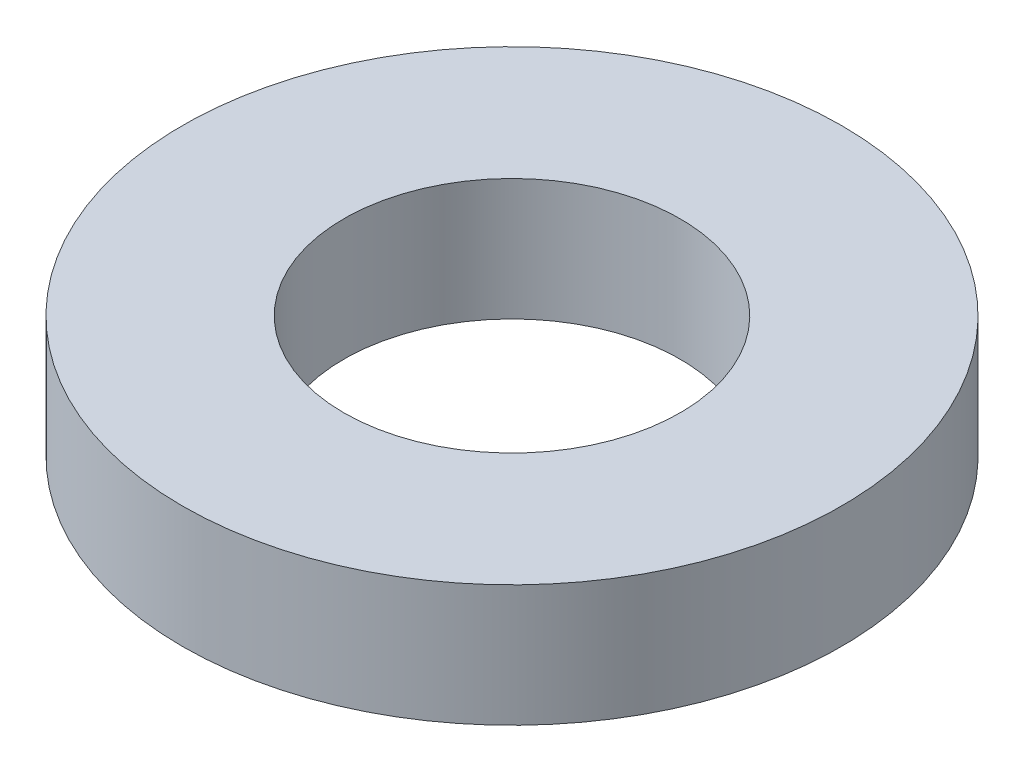
from build123d import *

# Parameters (mm, degrees)
SKETCH1_R           = 7.9375
BOSS_EXTRUDE1_DEPTH = 2.93
SKETCH3_R           = 4.05
CUT_EXTRUDE2_DEPTH  = 12.601409936


with BuildPart() as part:
    # Sketch1 → Boss-Extrude1 (new body)
    with BuildSketch(Plane(origin=(0, 0, 0), x_dir=(1, 0, 0), z_dir=(0, 1, 0))):
        with Locations(Location((0, 0, 0), (0, 0, 90))):
            Circle(SKETCH1_R)
    extrude(amount=BOSS_EXTRUDE1_DEPTH)

    # Sketch3 → Cut-Extrude2 (cut, through all)
    with BuildSketch(Plane(origin=(0, 2.93, 0), x_dir=(1, 0, 0), z_dir=(0, 1, 0))):
        with Locations(Location((0, 0, 0), (0, 0, 270))):
            Circle(SKETCH3_R)
    extrude(amount=-CUT_EXTRUDE2_DEPTH, mode=Mode.SUBTRACT)


solid = part.part
